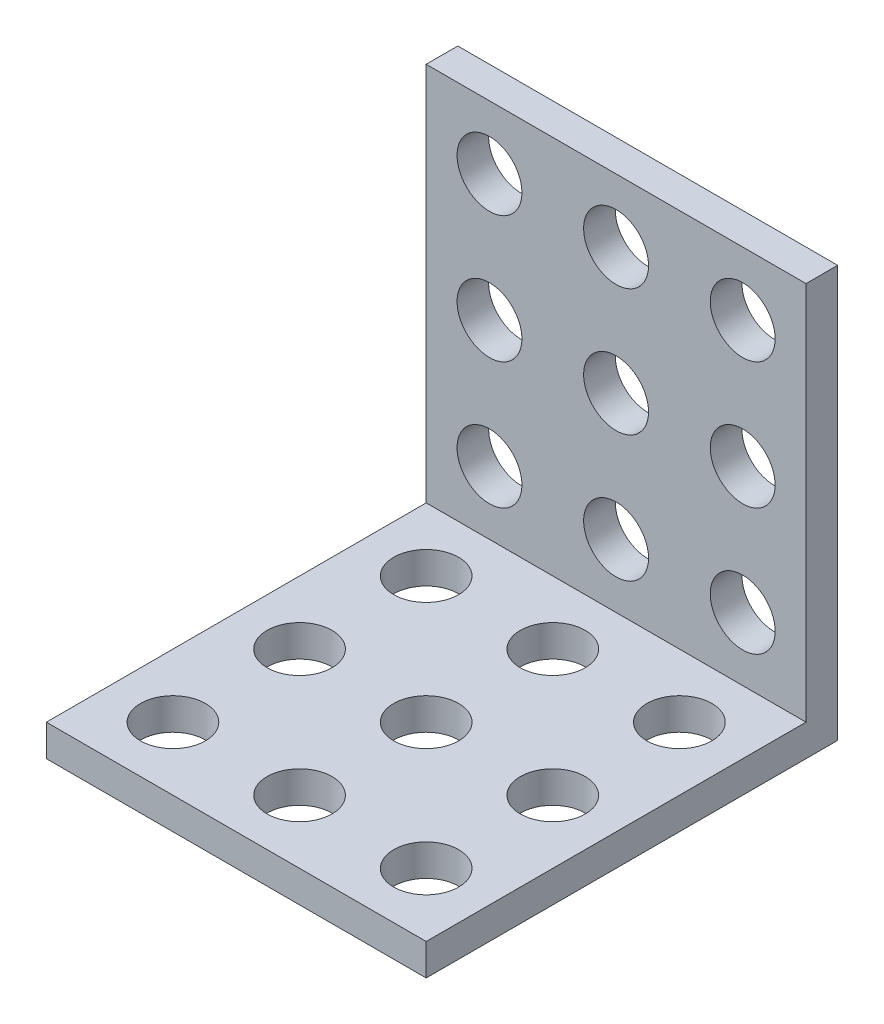
from build123d import *

# Parameters (mm, degrees)
BOSS_EXTRUDE1_DEPTH        = 24
F_4_1_4_1_DIAMETER_HOLE1_D = 4.1
LPATTERN1_COUNT            = 3
LPATTERN1_PITCH            = 8
LPATTERN1_COUNT_DIR2       = 3
LPATTERN1_PITCH_DIR2       = 8
MIRROR1_COPY_1_D           = 4.1
MIRROR1_COPY_2_D           = 4.1
MIRROR1_COPY_3_D           = 4.1
MIRROR1_COPY_4_D           = 4.1
MIRROR1_COPY_5_D           = 4.1
MIRROR1_COPY_6_D           = 4.1
MIRROR1_COPY_7_D           = 4.1
MIRROR1_COPY_8_D           = 4.1


with BuildPart() as part:
    # Sketch3 → Boss-Extrude1 (new body)
    with BuildSketch(Plane(origin=(0, 0, 0), x_dir=(0, 0, -1), z_dir=(1, 0, 0))):
        Polygon((0, 0), (0, 26), (-2, 26), (-2, 2), (-26, 2), (-26, 0), align=None)
    extrude(amount=BOSS_EXTRUDE1_DEPTH)

    # Ø4.1 (4.1) Diameter Hole1 (through all)
    with Locations(Plane.XY.offset(2)):
        with Locations((4, 22)):
            f_4_1_4_1_diameter_hole1 = Hole(F_4_1_4_1_DIAMETER_HOLE1_D / 2)

    # LPattern1: 4.1 _4.1_ Diameter Hole1 3 × 3
    with Locations(*[(i * LPATTERN1_PITCH, -j * LPATTERN1_PITCH_DIR2, 0) for i in range(LPATTERN1_COUNT) for j in range(LPATTERN1_COUNT_DIR2) if (i, j) != (0, 0)]):
        add(f_4_1_4_1_diameter_hole1, mode=Mode.SUBTRACT)

    # Mirror1: Ø4.1 (4.1) Diameter Hole1 across plane
    add(f_4_1_4_1_diameter_hole1.mirror(Plane(origin=(0, 0, 0), x_dir=(0, 0.7071067811865471, 0.7071067811865479), z_dir=(0, -0.7071067811865479, 0.7071067811865471))), mode=Mode.SUBTRACT)

    # Mirror1 copy 1 (through all)
    with Locations(Plane(origin=(0, 2, -8), x_dir=(1, 0, 0), z_dir=(0, 1, 0))):
        with Locations((4, -22)):
            Hole(MIRROR1_COPY_1_D / 2)

    # Mirror1 copy 2 (through all)
    with Locations(Plane(origin=(0, 2, -16), x_dir=(1, 0, 0), z_dir=(0, 1, 0))):
        with Locations((4, -22)):
            Hole(MIRROR1_COPY_2_D / 2)

    # Mirror1 copy 3 (through all)
    with Locations(Plane(origin=(8, 2, 0), x_dir=(1, 0, 0), z_dir=(0, 1, 0))):
        with Locations((4, -22)):
            Hole(MIRROR1_COPY_3_D / 2)

    # Mirror1 copy 4 (through all)
    with Locations(Plane(origin=(8, 2, -8), x_dir=(1, 0, 0), z_dir=(0, 1, 0))):
        with Locations((4, -22)):
            Hole(MIRROR1_COPY_4_D / 2)

    # Mirror1 copy 5 (through all)
    with Locations(Plane(origin=(8, 2, -16), x_dir=(1, 0, 0), z_dir=(0, 1, 0))):
        with Locations((4, -22)):
            Hole(MIRROR1_COPY_5_D / 2)

    # Mirror1 copy 6 (through all)
    with Locations(Plane(origin=(16, 2, 0), x_dir=(1, 0, 0), z_dir=(0, 1, 0))):
        with Locations((4, -22)):
            Hole(MIRROR1_COPY_6_D / 2)

    # Mirror1 copy 7 (through all)
    with Locations(Plane(origin=(16, 2, -8), x_dir=(1, 0, 0), z_dir=(0, 1, 0))):
        with Locations((4, -22)):
            Hole(MIRROR1_COPY_7_D / 2)

    # Mirror1 copy 8 (through all)
    with Locations(Plane(origin=(16, 2, -16), x_dir=(1, 0, 0), z_dir=(0, 1, 0))):
        with Locations((4, -22)):
            Hole(MIRROR1_COPY_8_D / 2)


solid = part.part
